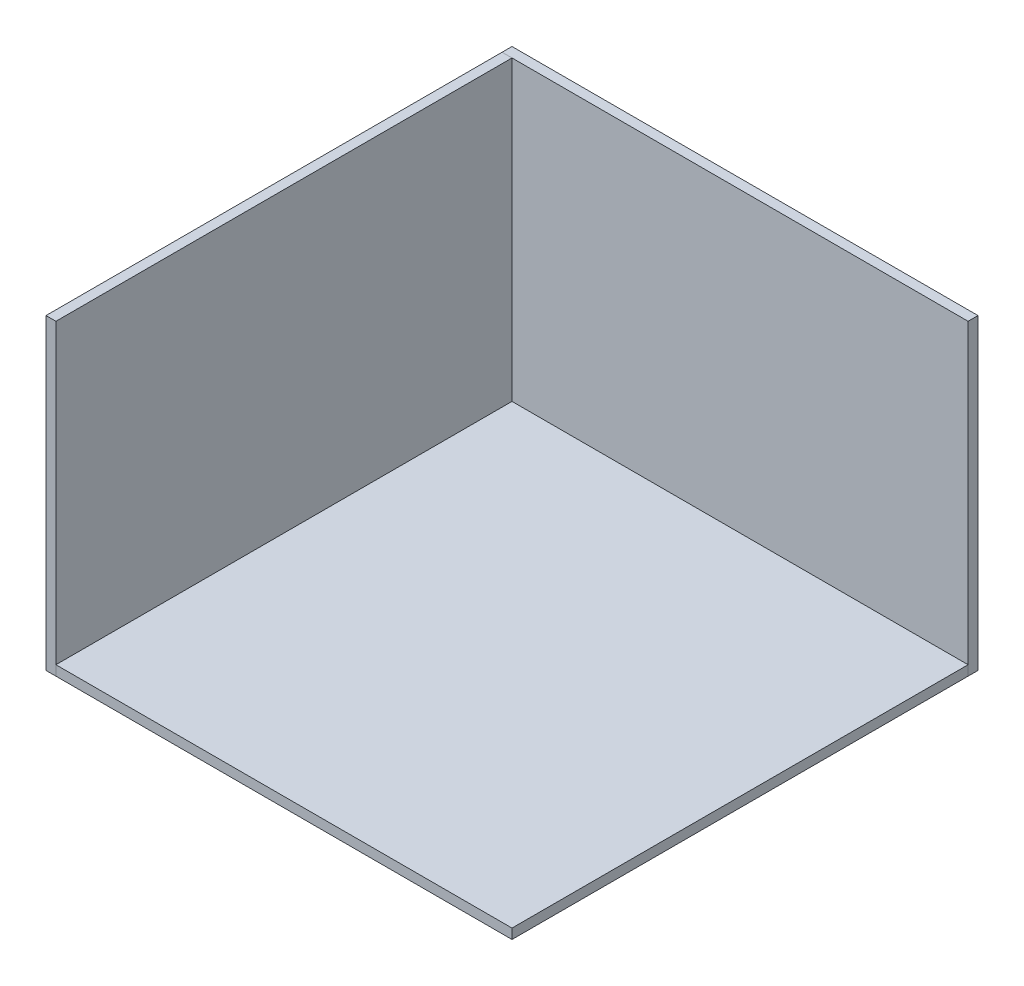
from build123d import *

# Parameters (mm, degrees)
SKETCH1_W           = 2300
SKETCH1_H           = 2300
BOSS_EXTRUDE1_DEPTH = 50
BOSS_EXTRUDE2_DEPTH = 1550
SKETCH3_W           = 50
SKETCH3_H           = 2300
BOSS_EXTRUDE3_DEPTH = 1550


with BuildPart() as part:
    # Sketch1 → Boss-Extrude1 (new body)
    with BuildSketch(Plane(origin=(0, 0, 0), x_dir=(1, 0, 0), z_dir=(0, 1, 0))):
        with Locations((1150, -1150)):
            Rectangle(SKETCH1_W, SKETCH1_H)
    extrude(amount=-BOSS_EXTRUDE1_DEPTH)


with BuildPart() as body_2:
    # Sketch2 → Boss-Extrude2 (new body)
    with BuildSketch(Plane.XZ.offset(50)):
        Polygon((0, 0), (2300, 0), (2300, -50), (-50, -50), (-50, 0), align=None)
    extrude(amount=-BOSS_EXTRUDE2_DEPTH)


with BuildPart() as body_3:
    # Sketch3 → Boss-Extrude3 (new body)
    with BuildSketch(Plane.XZ.offset(50)):
        with Locations((-25, 1150)):
            Rectangle(SKETCH3_W, SKETCH3_H)
    extrude(amount=-BOSS_EXTRUDE3_DEPTH)


solid = Compound([part.part, body_2.part, body_3.part])
